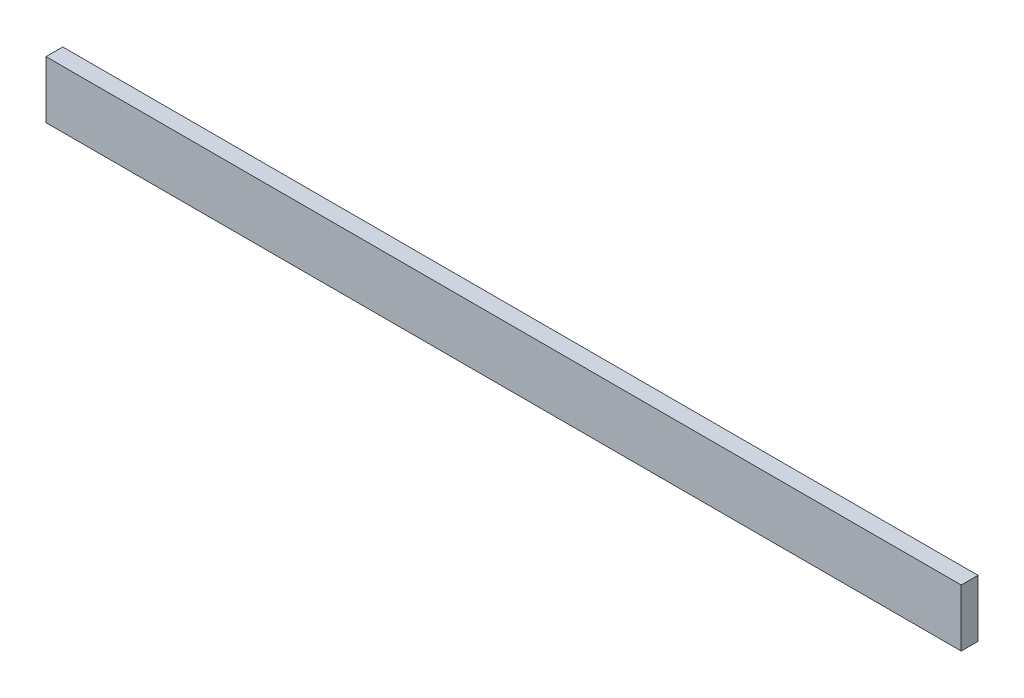
from build123d import *

# Parameters (mm, degrees)
SKETCH1_W           = 304.8
SKETCH1_H           = 19.05
BOSS_EXTRUDE1_DEPTH = 5.588


with BuildPart() as part:
    # Sketch1 → Boss-Extrude1 (new body)
    with BuildSketch(Plane.XY):
        Rectangle(SKETCH1_W, SKETCH1_H)
    extrude(amount=BOSS_EXTRUDE1_DEPTH)


solid = part.part
